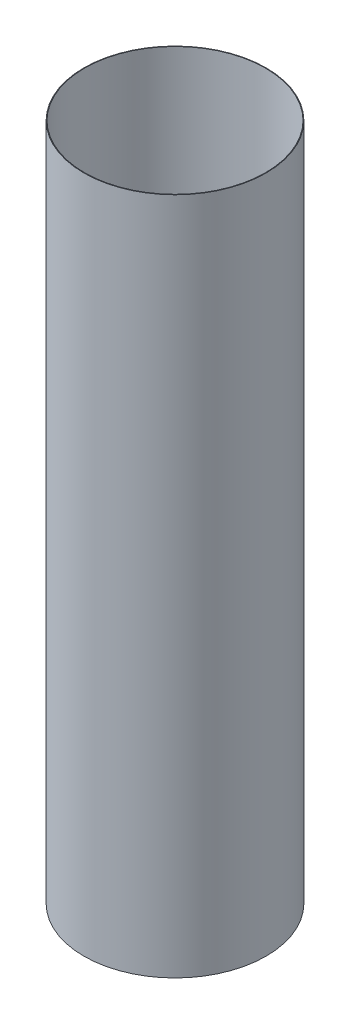
from build123d import *

# Parameters (mm, degrees)
SKETCH1_R           = 77.216
SKETCH1_R_2         = 76.708
BOSS_EXTRUDE1_DEPTH = 574.708528


with BuildPart() as part:
    # Sketch1 → Boss-Extrude1 (new body)
    with BuildSketch(Plane(origin=(0, 0, 0), x_dir=(1, 0, 0), z_dir=(0, 1, 0))):
        with Locations(Location((0, 0, 0), (0, 0, 270))):
            Circle(SKETCH1_R)
        with Locations(Location((0, 0, 0), (0, 0, 270))):
            Circle(SKETCH1_R_2, mode=Mode.SUBTRACT)
    extrude(amount=BOSS_EXTRUDE1_DEPTH)


solid = part.part
